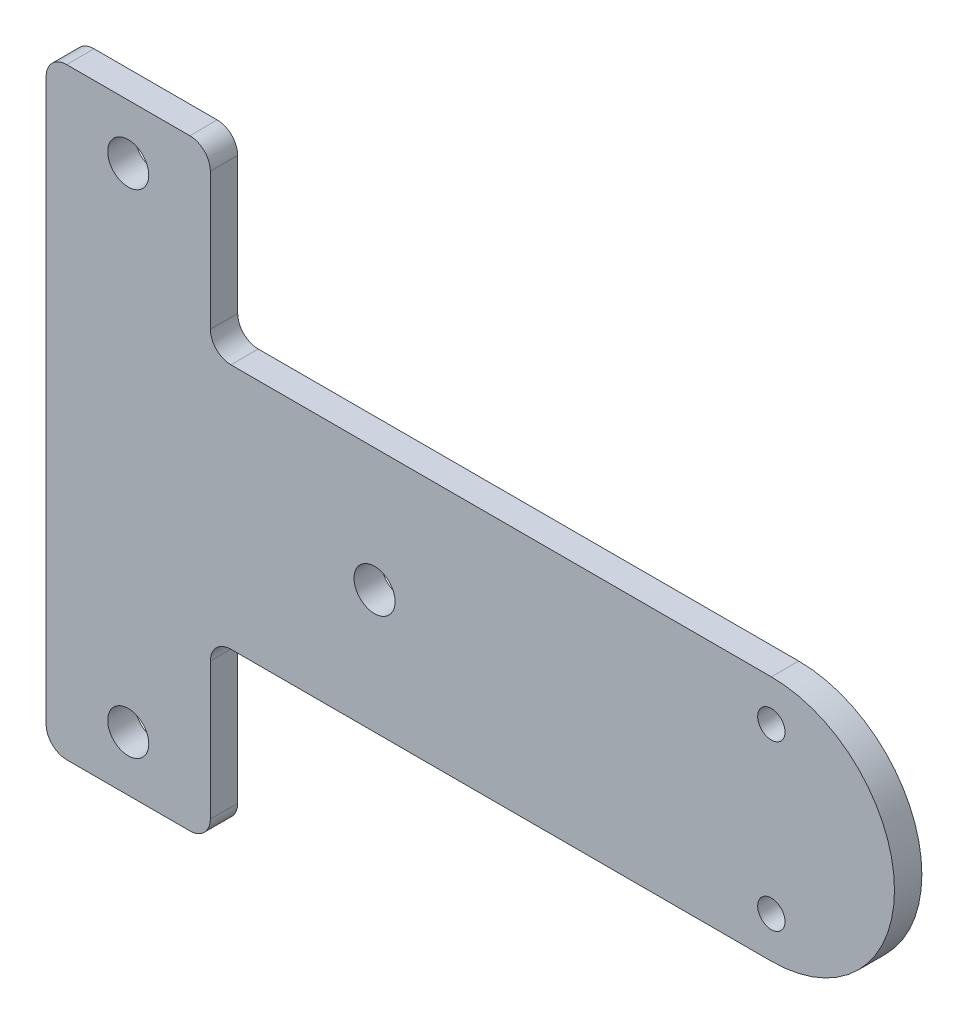
from build123d import *

# Parameters (mm, degrees)
SKETCH_1_R      = 1.5
SKETCH_1_R_2    = 1
EXTRUDE_1_DEPTH = 2
FILLET_1_R      = 1.5


with BuildPart() as part:
    # 草图1 → 凸台-拉伸1 (new body)
    with BuildSketch(Plane.XY):
        with BuildLine():
            Line((-1.723571429, -13.369911995), (-42.723571429, -13.369911995))
            Line((-42.723571429, -13.369911995), (-42.723571429, -26.369911995))
            Line((-42.723571429, -26.369911995), (-54.723571429, -26.369911995))
            Line((-54.723571429, -26.369911995), (-54.723571429, 17.630088005))
            Line((-54.723571429, 17.630088005), (-42.723571429, 17.630088005))
            Line((-42.723571429, 17.630088005), (-42.723571429, 4.630088005))
            Line((-42.723571429, 4.630088005), (-1.723571429, 4.630088005))
            ThreePointArc((-1.723571429, 4.630088005), (7.276428571, -4.369911995), (-1.723571429, -13.369911995))
        make_face()
        with Locations((-30.723571429, -4.369911995)):
            Circle(SKETCH_1_R, mode=Mode.SUBTRACT)
        with Locations((-48.723571429, 13.630088005)):
            Circle(SKETCH_1_R, mode=Mode.SUBTRACT)
        with Locations((-48.723571429, -22.369911995)):
            Circle(SKETCH_1_R, mode=Mode.SUBTRACT)
        with Locations((-1.723571429, 1.630088005)):
            Circle(SKETCH_1_R_2, mode=Mode.SUBTRACT)
        with Locations((-1.723571429, -10.369911995)):
            Circle(SKETCH_1_R_2, mode=Mode.SUBTRACT)
    extrude(amount=EXTRUDE_1_DEPTH)

    # 圆角1
    fillet_1_edges = [part.edges().sort_by_distance(p)[0] for p in [
        (-42.723571429, -13.369911995, 1),
        (-42.723571429, -26.369911995, 1),
        (-54.723571429, -26.369911995, 1),
        (-54.723571429, 17.630088005, 1),
        (-42.723571429, 17.630088005, 1),
        (-42.723571429, 4.630088005, 1),
    ]]
    fillet(fillet_1_edges, radius=FILLET_1_R)


solid = part.part
